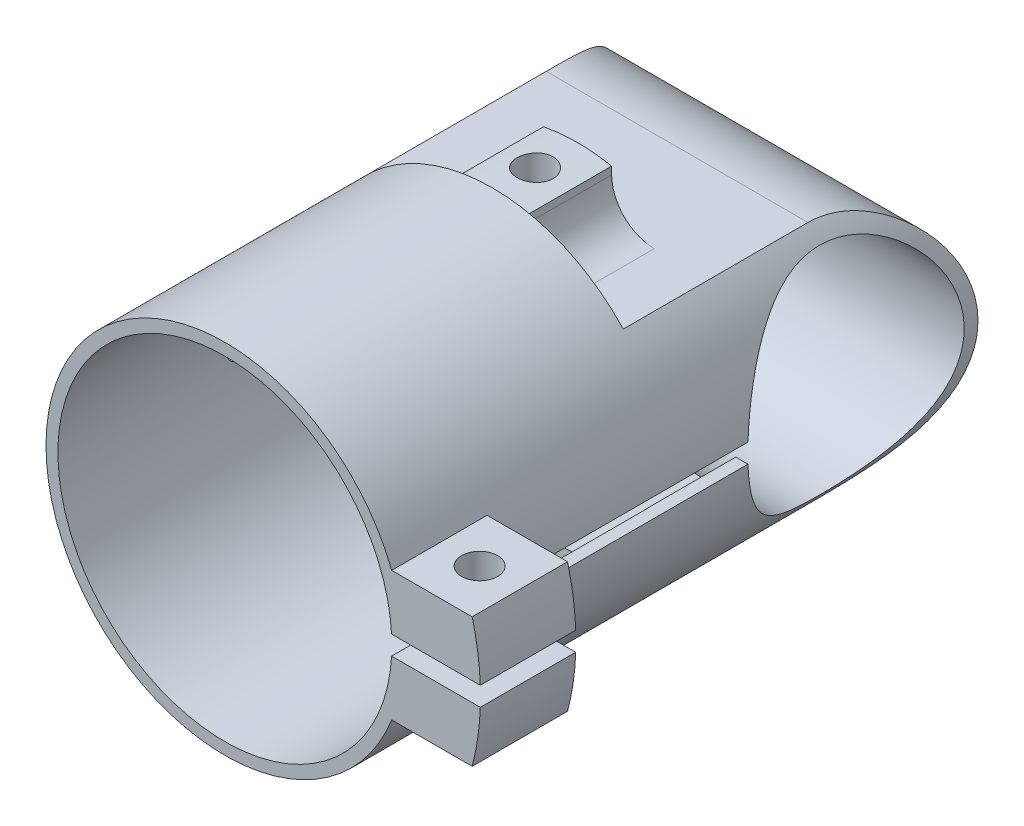
from build123d import *

# Parameters (mm, degrees)
SKETCH3_R           = 8.0645
CUT_EXTRUDE1_DEPTH  = 15.24
CUT_EXTRUDE2_DEPTH  = 15.24
CUT_EXTRUDE3_DEPTH  = 12.7
BOSS_EXTRUDE1_DEPTH = 6.35
SKETCH8_R           = 1.3462
CUT_EXTRUDE4_DEPTH  = 14.605
CUT_EXTRUDE5_DEPTH  = 29.21
SKETCH10_W          = 7.112
SKETCH10_H          = 9.652
BOSS_EXTRUDE2_DEPTH = 19.05
SKETCH11_R          = 12.446
CUT_EXTRUDE6_DEPTH  = 13.97
CUT_EXTRUDE8_DEPTH  = 13.97
SKETCH14_R          = 1.3462
CUT_EXTRUDE9_DEPTH  = 13.97
CUT_EXTRUDE10_START = 21.59
CUT_EXTRUDE10_DEPTH = 21.59
BOSS_EXTRUDE3_START = 2.54
BOSS_EXTRUDE3_DEPTH = 2.54
SCALE1_SCALE        = 0.6


with BuildPart() as part:
    # Sketch1 → Revolve1 (revolve)
    with BuildSketch(Plane(origin=(0, 0, 0), x_dir=(0, 0, -1), z_dir=(1, 0, 0)), mode=Mode.PRIVATE) as revolve1_sk:
        Polygon((0, 12.446), (0, 13.335), (42.799, 13.335), (42.799, 0), (19.05, 0), (19.05, 12.446), align=None)
    revolve(revolve1_sk.sketch.rotate(Axis((0, 0, 0), (0, 0, -1)), 90), axis=Axis((0, 0, 0), (0, 0, -1)))

    # Sketch3 → Cut-Extrude1 (cut, symmetric)
    with BuildSketch(Plane(origin=(0, 0, 0), x_dir=(0, 0, -1), z_dir=(1, 0, 0))):
        with Locations((33.7058, 0)):
            Circle(SKETCH3_R)
    extrude(amount=CUT_EXTRUDE1_DEPTH, both=True, mode=Mode.SUBTRACT)

    # Sketch5 → Cut-Extrude2 (cut, symmetric)
    with BuildSketch(Plane(origin=(0, 0, 0), x_dir=(0, 0, -1), z_dir=(1, 0, 0))):
        with BuildLine():
            Line((33.7058, 9.0932), (19.939, 9.0932))
            Line((19.939, 9.0932), (19.939, 13.335))
            Line((19.939, 13.335), (43.742849638, 13.335))
            Line((43.742849638, 13.335), (43.742849638, -13.335))
            Line((43.742849638, -13.335), (19.939, -13.335))
            Line((19.939, -13.335), (19.939, -9.0932))
            Line((19.939, -9.0932), (33.7058, -9.0932))
            ThreePointArc((33.7058, -9.0932), (42.799, 0), (33.7058, 9.0932))
        make_face()
    extrude(amount=CUT_EXTRUDE2_DEPTH, both=True, mode=Mode.SUBTRACT)

    # Sketch6 → Cut-Extrude3 (cut)
    with BuildSketch(Plane.XY.offset(-19.05)):
        with BuildLine():
            Line((-6.096, 6.35), (6.096, 6.35))
            ThreePointArc((6.096, 6.35), (12.446, 0), (6.096, -6.35))
            Line((6.096, -6.35), (-6.096, -6.35))
            ThreePointArc((-6.096, -6.35), (-12.446, 0), (-6.096, 6.35))
        make_face()
    extrude(amount=-CUT_EXTRUDE3_DEPTH, mode=Mode.SUBTRACT)

    # Sketch7 → Boss-Extrude1 (add)
    with BuildSketch(Plane(origin=(0, 0, -19.939), x_dir=(-1, 0, 0), z_dir=(0, 0, -1))):
        with BuildLine():
            Line((-5.715, 9.0932), (5.715, 9.0932))
            ThreePointArc((5.715, 9.0932), (3.46993597, 10.02313597), (2.54, 12.2682))
            Line((2.54, 12.2682), (2.54, 12.832028717))
            ThreePointArc((2.54, 12.832028717), (0, 13.081), (-2.54, 12.832028717))
            Line((-2.54, 12.832028717), (-2.54, 12.2682))
            ThreePointArc((-2.54, 12.2682), (-3.46993597, 10.02313597), (-5.715, 9.0932))
        make_face()
    extrude(amount=BOSS_EXTRUDE1_DEPTH)

    # Sketch8 → Cut-Extrude4 (cut, symmetric)
    with BuildSketch(Plane(origin=(0, 0, 0), x_dir=(1, 0, 0), z_dir=(0, 1, 0))):
        with Locations(Location((0, 23.114, 0), (0, 0, 270))):
            Circle(SKETCH8_R)
    extrude(amount=CUT_EXTRUDE4_DEPTH, both=True, mode=Mode.SUBTRACT)

    # Sketch9 → Cut-Extrude5 (cut)
    with BuildSketch(Plane(origin=(0, 0, 0), x_dir=(0, 0, -1), z_dir=(1, 0, 0))):
        with BuildLine():
            Line((28.696128941, 0.7112), (13.335, 0.7112))
            ThreePointArc((13.335, 0.7112), (12.6238, 0), (13.335, -0.7112))
            Line((13.335, -0.7112), (28.696128941, -0.7112))
            Line((28.696128941, -0.7112), (28.696128941, 0.7112))
        make_face()
    extrude(amount=-CUT_EXTRUDE5_DEPTH, mode=Mode.SUBTRACT)

    # Sketch10 → Boss-Extrude2 (add)
    with BuildSketch(Plane(origin=(0, 0, 0), x_dir=(0, 0, -1), z_dir=(1, 0, 0))):
        with Locations((3.556, 0)):
            Rectangle(SKETCH10_W, SKETCH10_H)
    extrude(amount=BOSS_EXTRUDE2_DEPTH)

    # Sketch11 → Cut-Extrude6 (cut)
    with BuildSketch(Plane.XY):
        Circle(SKETCH11_R)
    extrude(amount=-CUT_EXTRUDE6_DEPTH, mode=Mode.SUBTRACT)

    # Sketch13 → Cut-Extrude8 (cut)
    with BuildSketch(Plane.XY):
        with BuildLine():
            Line((19.689857662, 4.826), (19.689857662, -4.826))
            Line((19.689857662, -4.826), (18.428570862, -4.826))
            ThreePointArc((18.428570862, -4.826), (19.05, 0), (18.428570862, 4.826))
            Line((18.428570862, 4.826), (19.689857662, 4.826))
        make_face()
    extrude(amount=-CUT_EXTRUDE8_DEPTH, mode=Mode.SUBTRACT)

    # Sketch14 → Cut-Extrude9 (cut)
    with BuildSketch(Plane(origin=(0, 4.826, 0), x_dir=(1, 0, 0), z_dir=(0, 1, 0))):
        with Locations(Location((15.429829434, 3.556, 0), (0, 0, 270))):
            Circle(SKETCH14_R)
    extrude(amount=-CUT_EXTRUDE9_DEPTH, mode=Mode.SUBTRACT)

    # Sketch15 → Cut-Extrude10 (cut)
    with BuildSketch(Plane(origin=(0, 0, 0), x_dir=(0, 0, -1), z_dir=(1, 0, 0)).offset(CUT_EXTRUDE10_START)):
        with BuildLine():
            Line((0, 0.7112), (25.672721212, 0.7112))
            ThreePointArc((25.672721212, 0.7112), (25.6413, 0), (25.672721212, -0.7112))
            Line((25.672721212, -0.7112), (0, -0.7112))
            Line((0, -0.7112), (0, 0.7112))
        make_face()
    extrude(amount=-CUT_EXTRUDE10_DEPTH, mode=Mode.SUBTRACT)

    # Sketch16 → Boss-Extrude3 (add)
    with BuildSketch(Plane.XY.offset(-19.05).offset(BOSS_EXTRUDE3_START)):
        with BuildLine():
            Line((-0.5715, 10.641698231), (-0.5715, 10.367746169))
            Line((-0.5715, 10.367746169), (0.5715, 10.367746169))
            Line((0.5715, 10.367746169), (0.5715, 10.641698231))
            ThreePointArc((0.5715, 10.641698231), (1.154243176, 11.870771042), (2.474643275, 12.197502066))
            ThreePointArc((2.474643275, 12.197502066), (0, 12.446), (-2.474643275, 12.197502066))
            ThreePointArc((-2.474643275, 12.197502066), (-1.154243176, 11.870771042), (-0.5715, 10.641698231))
        make_face()
    extrude(amount=-BOSS_EXTRUDE3_DEPTH)


with BuildPart() as part_1:
    # Scale1: scaled about (1.039780089, 0.353442255, -20.719141089)
    add(part.part.scale(SCALE1_SCALE).moved(Location((0.415912036, 0.141376902, -8.287656436))))


solid = part_1.part
